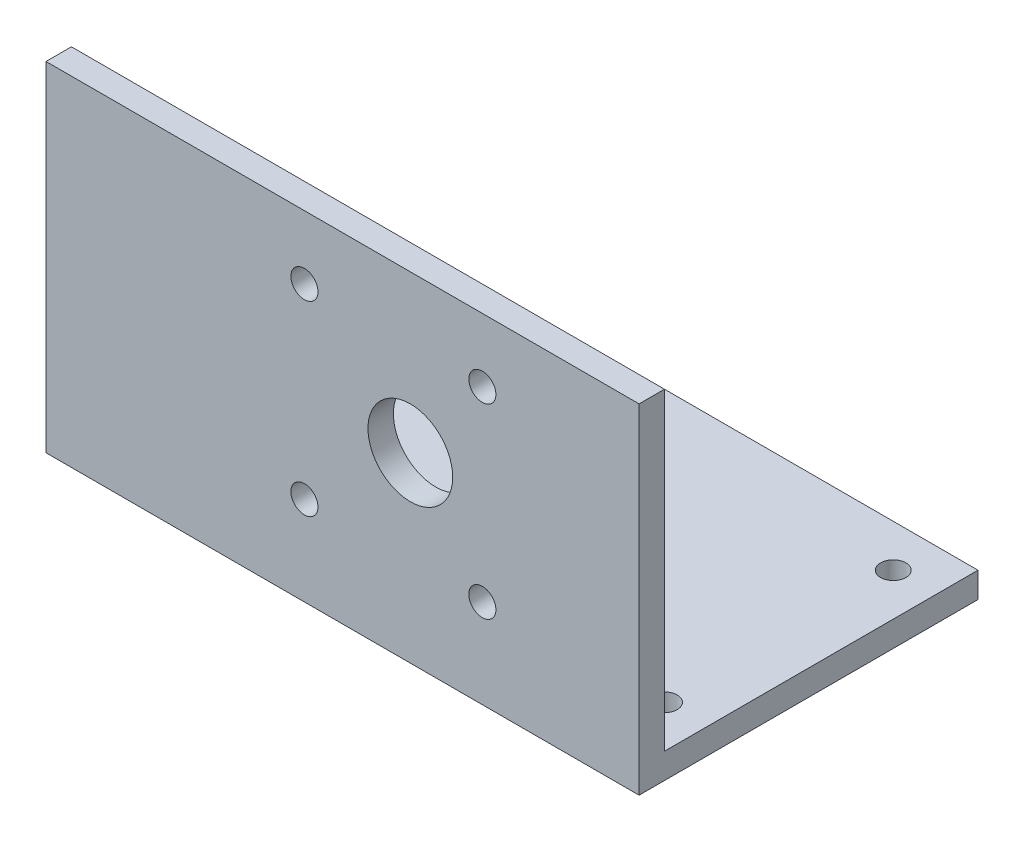
from build123d import *

# Parameters (mm, degrees)
EXTRUDE_1_DEPTH     = 70
SKETCH_2_R          = 5
SKETCH_2_R_2        = 1.6
CUT_EXTRUDE_1_DEPTH = 3
SKETCH_3_R          = 1.5
CUT_EXTRUDE_2_DEPTH = 3


with BuildPart() as part:
    # Эскиз1 → Бобышка-Вытянуть1 (new body)
    with BuildSketch(Plane(origin=(0, 0, 0), x_dir=(0, 0, -1), z_dir=(1, 0, 0))):
        Polygon((-20, 20), (-17, 20), (-17, -17), (20, -17), (20, -20), (-20, -20), align=None)
    extrude(amount=EXTRUDE_1_DEPTH)

    # Эскиз2 → Вырез-Вытянуть1 (cut)
    with BuildSketch(Plane.XY.offset(20)):
        with Locations((43, 1.5)):
            Circle(SKETCH_2_R)
        with Locations((51.5, 12.5)):
            Circle(SKETCH_2_R_2)
        with Locations((30.5, 12.5)):
            Circle(SKETCH_2_R_2)
        with Locations((30.5, -9.5)):
            Circle(SKETCH_2_R_2)
        with Locations((51.5, -9.5)):
            Circle(SKETCH_2_R_2)
    extrude(amount=-CUT_EXTRUDE_1_DEPTH, mode=Mode.SUBTRACT)

    # Эскиз3 → Вырез-Вытянуть2 (cut)
    with BuildSketch(Plane(origin=(0, -17, 0), x_dir=(1, 0, 0), z_dir=(0, 1, 0))):
        with Locations(Location((65, -12, 0), (0, 0, 270))):
            Circle(SKETCH_3_R)
        with Locations(Location((65, 15, 0), (0, 0, 270))):
            Circle(SKETCH_3_R)
        with Locations(Location((5, 15, 0), (0, 0, 270))):
            Circle(SKETCH_3_R)
        with Locations(Location((5, -12, 0), (0, 0, 270))):
            Circle(SKETCH_3_R)
    extrude(amount=-CUT_EXTRUDE_2_DEPTH, mode=Mode.SUBTRACT)


solid = part.part
